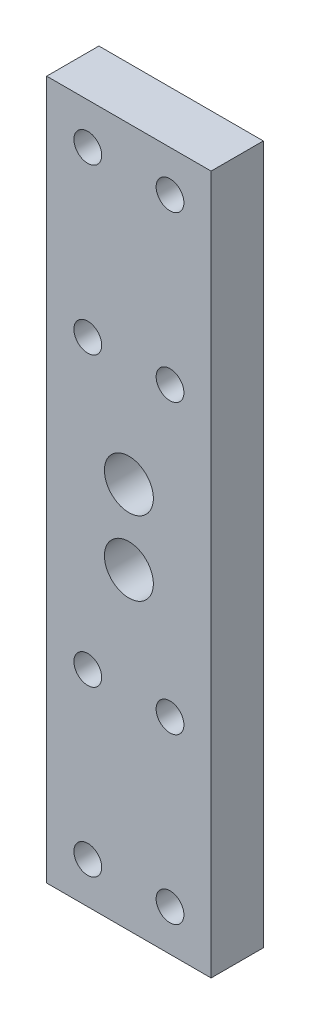
from build123d import *

# Parameters (mm, degrees)
CROQUIS1_W                     = 40
CROQUIS1_H                     = 170
SALIENTE_EXTRUIR1_DEPTH        = 6.35
TALADRO_DE_MARGEN_PARA_1_41_D  = 6.7564
TALADRO_DE_MARGEN_PARA_7_161_D = 11.90498


with BuildPart() as part:
    # Croquis1 → Saliente-Extruir1 (new, symmetric)
    with BuildSketch(Plane.XY):
        Rectangle(CROQUIS1_W, CROQUIS1_H)
    extrude(amount=SALIENTE_EXTRUIR1_DEPTH, both=True)

    # Taladro de margen para 1/41 (through all)
    with Locations(Plane.XY.offset(6.35)):
        with Locations((10, 75), (10, 35), (-10, 35), (-10, 75), (-10, -75), (-10, -35), (10, -35), (10, -75)):
            Hole(TALADRO_DE_MARGEN_PARA_1_41_D / 2)

    # Taladro de margen para 7/161 (through all)
    with Locations(Plane(origin=(0, 0, -6.35), x_dir=(-1, 0, 0), z_dir=(0, 0, -1))):
        with Locations((0, -9), (0, 9)):
            Hole(TALADRO_DE_MARGEN_PARA_7_161_D / 2)


solid = part.part
